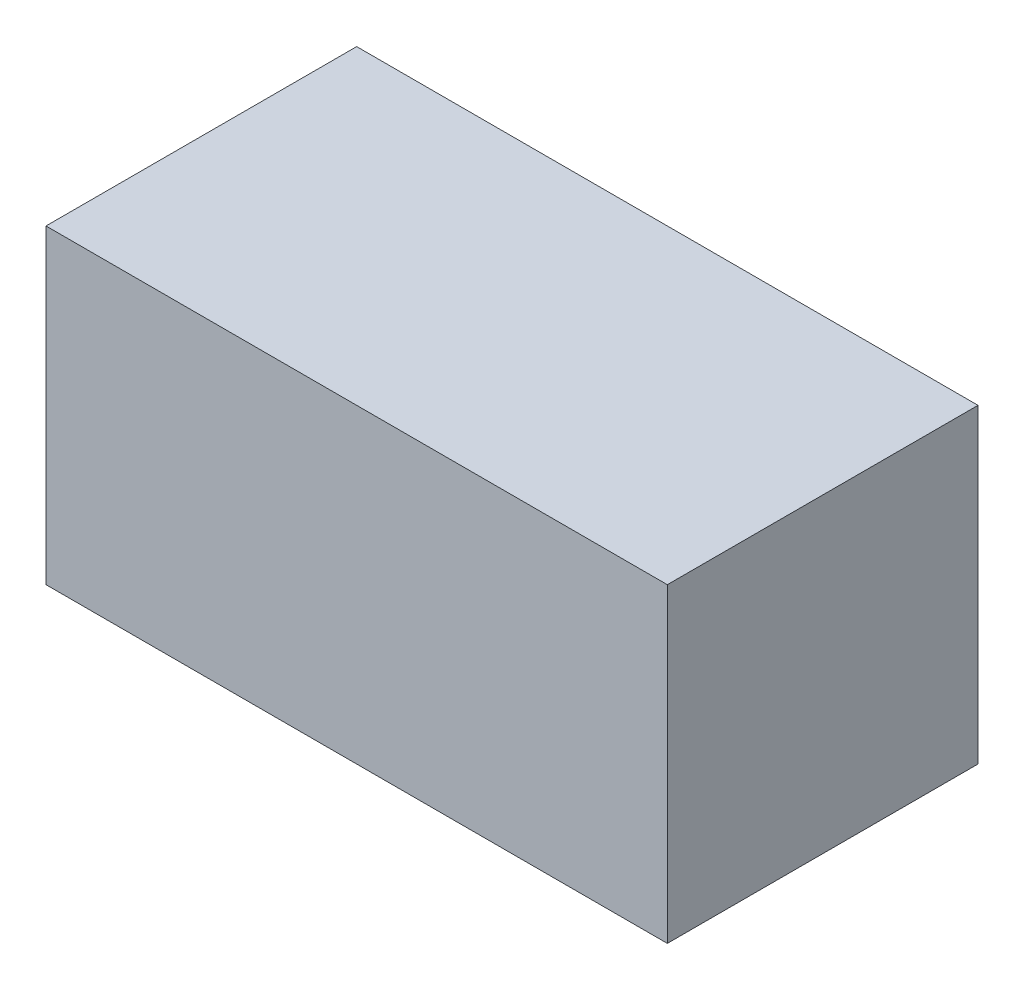
from build123d import *

# Parameters (mm, degrees)
SKETCH1_W           = 0.6
SKETCH1_H           = 0.3
BOSS_EXTRUDE1_DEPTH = 0.3


with BuildPart() as part:
    # Sketch1 → Boss-Extrude1 (new body)
    with BuildSketch(Plane.XY):
        with Locations((0.3, 0.15)):
            Rectangle(SKETCH1_W, SKETCH1_H)
    extrude(amount=BOSS_EXTRUDE1_DEPTH)


solid = part.part
